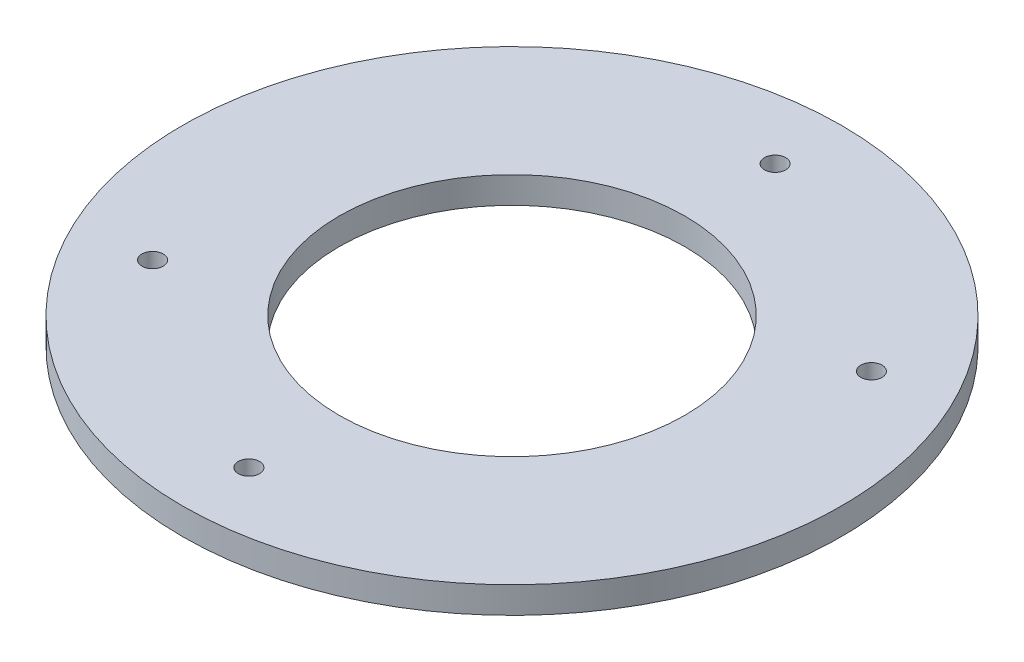
from build123d import *

# Parameters (mm, degrees)
SKETCH1_R               = 62
BOSS_EXTRUDE1_DEPTH     = 5
SKETCH2_R               = 2
CUT_EXTRUDE1_DEPTH      = 5
CIRPATTERN1_COUNT       = 2
CIRPATTERN1_ANGLE       = 120
MIRROR1_COPY_1_SKETCH_R = 2
MIRROR1_COPY_1_DEPTH    = 5
SKETCH5_R               = 32.5
CUT_EXTRUDE2_DEPTH      = 10


with BuildPart() as part:
    # Sketch1 → Boss-Extrude1 (new body)
    with BuildSketch(Plane(origin=(0, 0, 0), x_dir=(1, 0, 0), z_dir=(0, 1, 0))):
        with Locations(Location((0, 0, 0), (0, 0, 270))):
            Circle(SKETCH1_R)
    extrude(amount=BOSS_EXTRUDE1_DEPTH)

    # Sketch2 → Cut-Extrude1 (cut)
    with BuildSketch(Plane(origin=(0, 5, 0), x_dir=(1, 0, 0), z_dir=(0, 1, 0))):
        with Locations(Location((0, 49.5, 0), (0, 0, 270))):
            Circle(SKETCH2_R)
    cut_extrude1 = extrude(amount=-CUT_EXTRUDE1_DEPTH, mode=Mode.SUBTRACT)

    # CirPattern1: Cut-Extrude1 ×2 about axis
    cirpattern1_axis = Axis((0, 5, 0), (0, 1, 0))
    for i in range(1, CIRPATTERN1_COUNT):
        add(cut_extrude1.rotate(cirpattern1_axis, i * CIRPATTERN1_ANGLE / (CIRPATTERN1_COUNT - 1)), mode=Mode.SUBTRACT)

    # Mirror1: Cut-Extrude1 across plane
    add(cut_extrude1.mirror(Plane(origin=(0, 0, 0), x_dir=(-0.49999999999999806, 0, 0.8660254037844398), z_dir=(-0.8660254037844398, 0, -0.49999999999999806))), mode=Mode.SUBTRACT)

    # Mirror1 copy 1 sketch → Mirror1 copy 1 (cut)
    with BuildSketch(Plane(origin=(0, 5, 0), x_dir=(1, 0, 0), z_dir=(0, 1, 0))):
        with Locations((0, -49.5)):
            Circle(MIRROR1_COPY_1_SKETCH_R)
    extrude(amount=-MIRROR1_COPY_1_DEPTH, mode=Mode.SUBTRACT)

    # Sketch5 → Cut-Extrude2 (cut)
    with BuildSketch(Plane.XZ):
        with Locations(Location((0, 0, 0), (0, 0, 270))):
            Circle(SKETCH5_R)
    extrude(amount=-CUT_EXTRUDE2_DEPTH, mode=Mode.SUBTRACT)


solid = part.part
